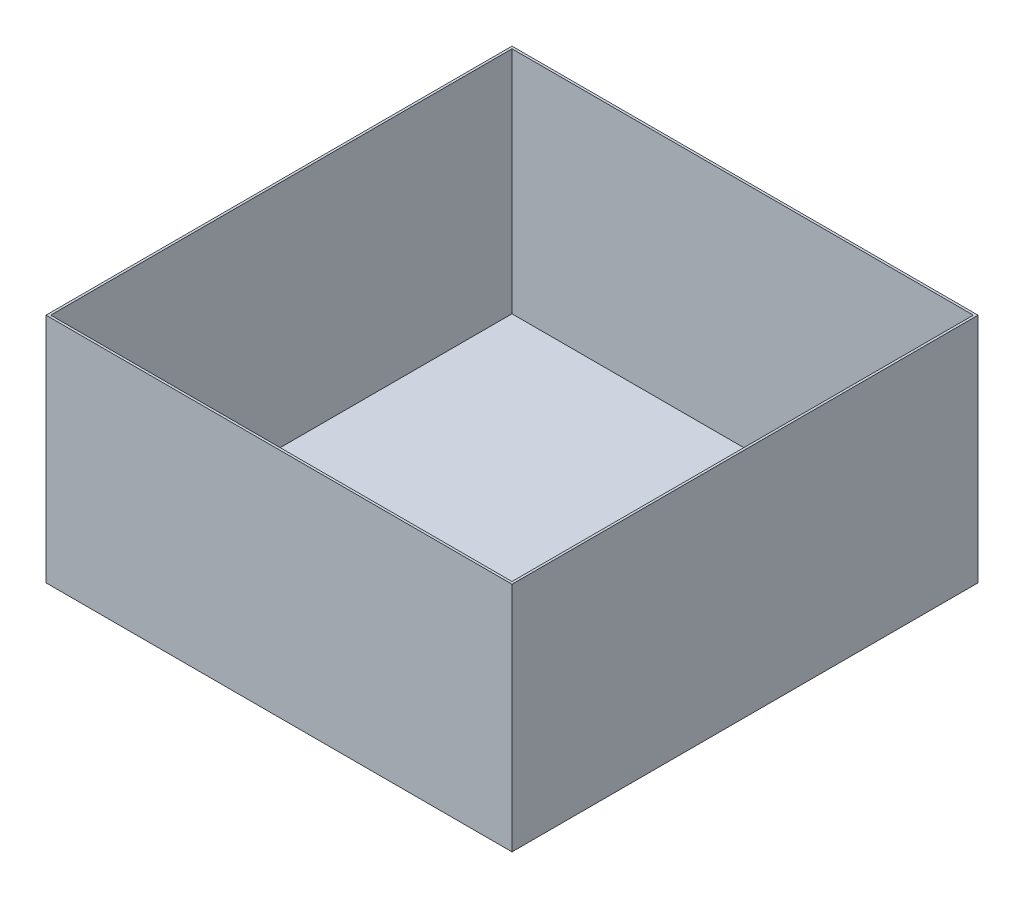
from build123d import *

# Parameters (mm, degrees)
CROQUIS1_W              = 201
CROQUIS1_H              = 201
SALIENTE_EXTRUIR1_DEPTH = 100
VACIADO1_T              = -1


with BuildPart() as part:
    # Croquis1 → Saliente-Extruir1 (new body)
    with BuildSketch(Plane(origin=(0, 0, 0), x_dir=(1, 0, 0), z_dir=(0, 1, 0))):
        with Locations((59.116890843, -76.386715501)):
            Rectangle(CROQUIS1_W, CROQUIS1_H)
    extrude(amount=SALIENTE_EXTRUIR1_DEPTH)

    # Vaciado1
    vaciado1_openings = [part.faces().sort_by_distance(p)[0] for p in [
        (59.116890843, 100, 76.386715501),
    ]]
    offset(amount=VACIADO1_T, openings=vaciado1_openings, kind=Kind.INTERSECTION)


solid = part.part
